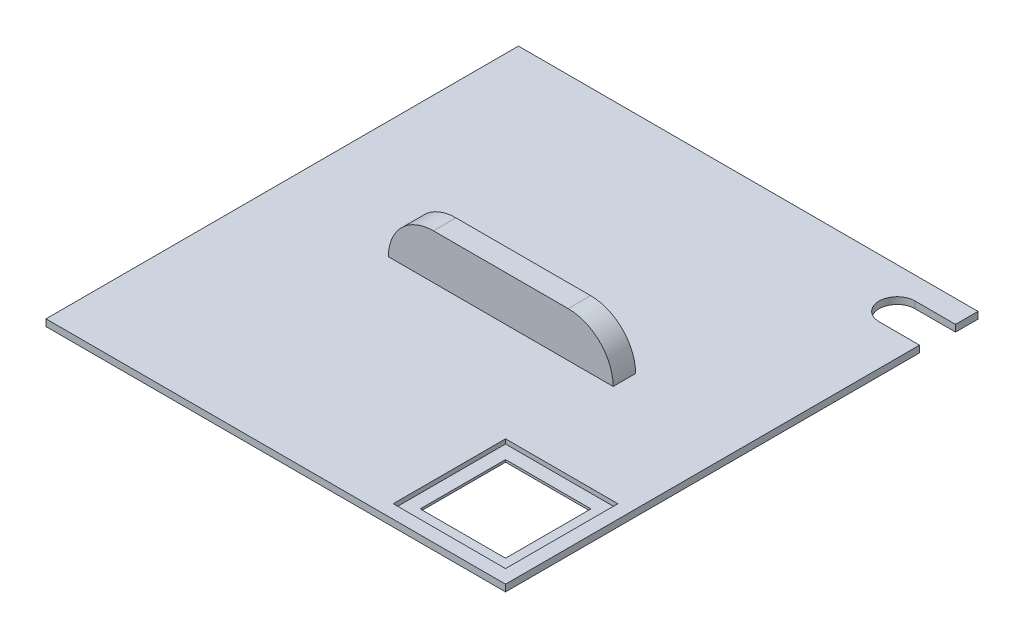
from build123d import *

# Parameters (mm, degrees)
BOSS_EXTRUDE1_DEPTH = 1.5
SKETCH2_W           = 30
SKETCH2_H           = 5
BOSS_EXTRUDE2_DEPTH = 10
SKETCH3_W           = 10
SKETCH3_H           = 5
REVOLVE_THIN1_ANGLE = 180
SKETCH5_W           = 25
SKETCH5_H           = 25
CUT_EXTRUDE1_DEPTH  = 1
SKETCH6_W           = 19
SKETCH6_H           = 19
CUT_EXTRUDE2_DEPTH  = 3


with BuildPart() as part:
    # Sketch1 → Boss-Extrude1 (new body)
    with BuildSketch(Plane(origin=(0, 0, 0), x_dir=(1, 0, 0), z_dir=(0, 1, 0))):
        with BuildLine():
            ThreePointArc((42.125, 39.560795807), (38.125, 43.560795807), (42.125, 47.560795807))
            Line((42.125, 47.560795807), (51.125, 47.560795807))
            Line((51.125, 47.560795807), (51.125, 52.560795807))
            Line((51.125, 52.560795807), (-51.125, 52.560795807))
            Line((-51.125, 52.560795807), (-51.125, -52.560795807))
            Line((-51.125, -52.560795807), (51.125, -52.560795807))
            Line((51.125, -52.560795807), (51.125, 39.560795807))
            Line((51.125, 39.560795807), (42.125, 39.560795807))
        make_face()
    extrude(amount=BOSS_EXTRUDE1_DEPTH)

    # Sketch2 → Boss-Extrude2 (add)
    with BuildSketch(Plane(origin=(0, 1.5, 0), x_dir=(1, 0, 0), z_dir=(0, 1, 0))):
        Rectangle(SKETCH2_W, SKETCH2_H)
    extrude(amount=BOSS_EXTRUDE2_DEPTH)

    # Sketch3 → Revolve-Thin1 (revolve)
    with BuildSketch(Plane(origin=(0, 1.5, 0), x_dir=(1, 0, 0), z_dir=(0, 1, 0))):
        with Locations((-20, 0)):
            Rectangle(SKETCH3_W, SKETCH3_H)
    revolve_thin1 = revolve(axis=Axis((-15, 1.5, 2.5), (0, 0, -1)), revolution_arc=REVOLVE_THIN1_ANGLE)

    # Mirror1: Revolve-Thin1 across plane
    add(revolve_thin1.mirror(Plane(origin=(0, 0, 0), x_dir=(0, 0, 1), z_dir=(1, 0, 0))))

    # Sketch5 → Cut-Extrude1 (cut)
    with BuildSketch(Plane(origin=(0, 1.5, 0), x_dir=(1, 0, 0), z_dir=(0, 1, 0))):
        with Locations((35.625, -37.060795807)):
            Rectangle(SKETCH5_W, SKETCH5_H)
    extrude(amount=-CUT_EXTRUDE1_DEPTH, mode=Mode.SUBTRACT)

    # Sketch6 → Cut-Extrude2 (cut)
    with BuildSketch(Plane(origin=(0, 0.5, 0), x_dir=(1, 0, 0), z_dir=(0, 1, 0))):
        with Locations((35.625, -37.060795807)):
            Rectangle(SKETCH6_W, SKETCH6_H)
    extrude(amount=-CUT_EXTRUDE2_DEPTH, mode=Mode.SUBTRACT)


solid = part.part
